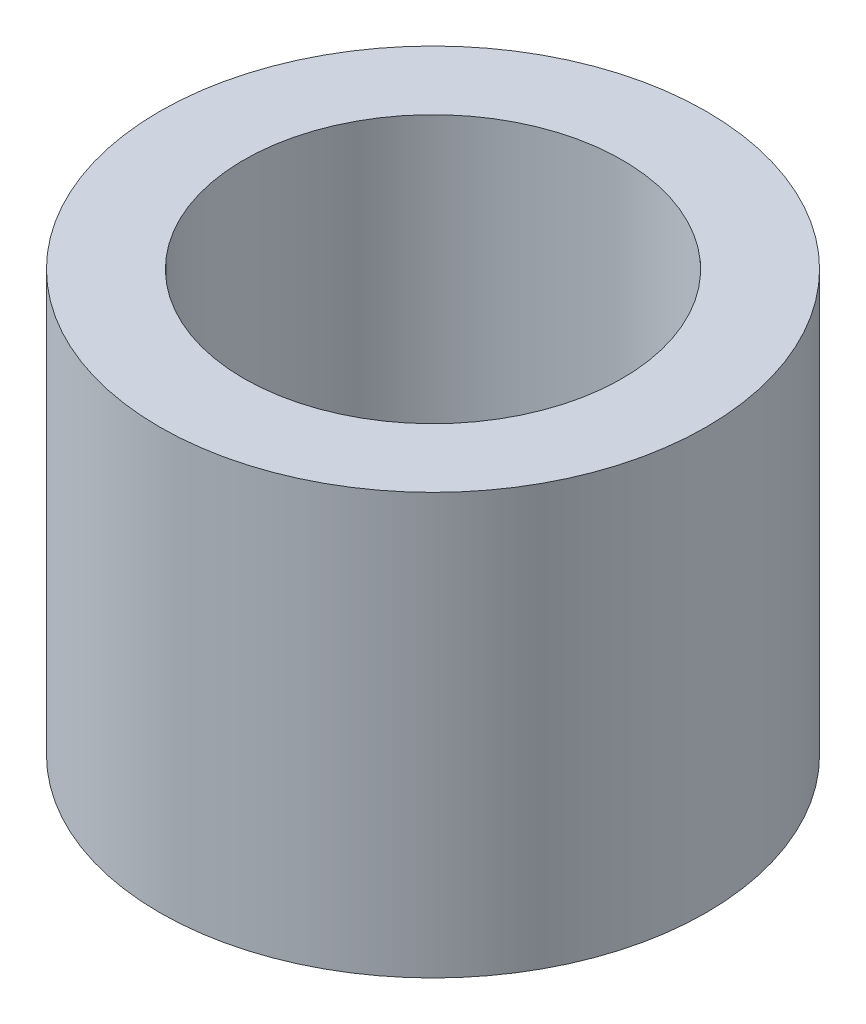
from build123d import *

# Parameters (mm, degrees)
SKETCH_1_R      = 3.25
SKETCH_1_R_2    = 2.25
EXTRUDE_1_DEPTH = 5


with BuildPart() as part:
    # 草图1 → 凸台-拉伸1 (new body)
    with BuildSketch(Plane(origin=(0, 0, 0), x_dir=(1, 0, 0), z_dir=(0, 1, 0))):
        with Locations(Location((0, 0, 0), (0, 0, 270))):
            Circle(SKETCH_1_R)
        with Locations(Location((0, 0, 0), (0, 0, 270))):
            Circle(SKETCH_1_R_2, mode=Mode.SUBTRACT)
    extrude(amount=EXTRUDE_1_DEPTH)


solid = part.part
